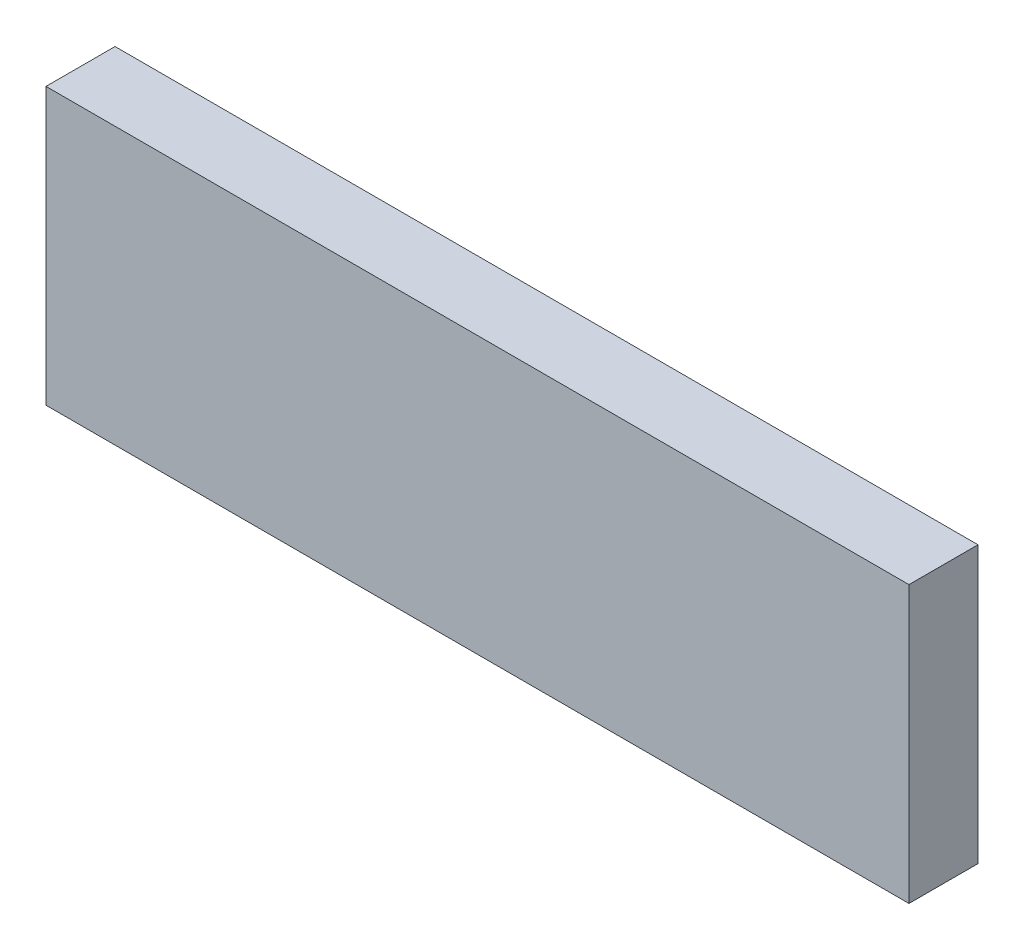
from build123d import *

# Parameters (mm, degrees)
SKETCH_1_W      = 250
SKETCH_1_H      = 80
EXTRUDE_1_DEPTH = 20


with BuildPart() as part:
    # 草图1 → 凸台-拉伸1 (new body)
    with BuildSketch(Plane.XY):
        Rectangle(SKETCH_1_W, SKETCH_1_H)
    extrude(amount=EXTRUDE_1_DEPTH)


solid = part.part
